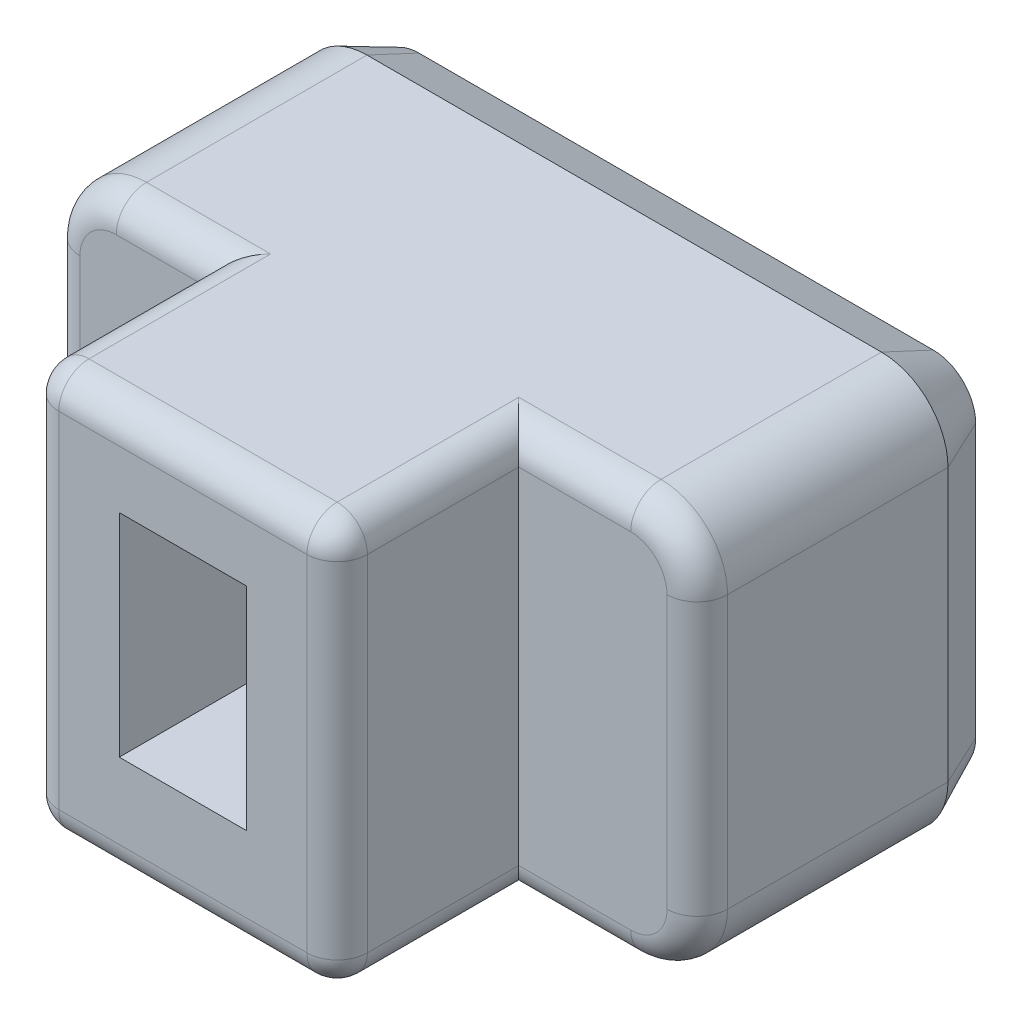
from build123d import *

# Parameters (mm, degrees)
BOSS_EXTRU_1_DEPTH      = 8
ESQUISSE3_W             = 2.1
ESQUISSE3_H             = 3.5
ENL_V_MAT_EXTRU_1_DEPTH = 3
ESQUISSE4_OUTSIDE_W     = 15.69
ESQUISSE4_OUTSIDE_H     = 11.69
ESQUISSE4_OUTSIDE_W_2   = 5.1
ESQUISSE4_OUTSIDE_H_2   = 6.7
ENL_V_MAT_EXTRU_2_DEPTH = 3
CONG_1_R                = 0.5
CHANFREIN1_SIZE         = 0.4
CHANFREIN1_SIZE2        = 0.857802768
ENL_V_MAT_EXTRU_3_DEPTH = 0.3
BOSS_EXTRU_2_START      = -0.2
BOSS_EXTRU_2_DEPTH      = 0.2
BOSS_EXTRU_2_2_DEPTH    = 0.2
BOSS_EXTRU_2_3_DEPTH    = 0.2


with BuildPart() as part:
    # Esquisse2 → Boss.-Extru.1 (new body)
    with BuildSketch(Plane.XY):
        with BuildLine():
            Line((1.1, 0), (9.6, 0))
            ThreePointArc((9.6, 0), (10.377817459, 0.322182541), (10.7, 1.1))
            Line((10.7, 1.1), (10.7, 5.6))
            ThreePointArc((10.7, 5.6), (10.377817459, 6.377817459), (9.6, 6.7))
            Line((9.6, 6.7), (1.1, 6.7))
            ThreePointArc((1.1, 6.7), (0.322182541, 6.377817459), (0, 5.6))
            Line((0, 5.6), (0, 1.1))
            ThreePointArc((0, 1.1), (0.322182541, 0.322182541), (1.1, 0))
        make_face()
    extrude(amount=BOSS_EXTRU_1_DEPTH)

    # Esquisse3 → Enlèv. mat.-Extru.1 (cut)
    with BuildSketch(Plane.XY.offset(8)):
        with Locations((5.2, 3.5)):
            Rectangle(ESQUISSE3_W, ESQUISSE3_H)
    extrude(amount=-ENL_V_MAT_EXTRU_1_DEPTH, mode=Mode.SUBTRACT)

    # Esquisse4 outside → Enlèv. mat.-Extru.2 (cut)
    with BuildSketch(Plane.XY.offset(8)):
        with Locations((5.35, 3.35)):
            Rectangle(ESQUISSE4_OUTSIDE_W, ESQUISSE4_OUTSIDE_H)
        with Locations((5.2, 3.35)):
            Rectangle(ESQUISSE4_OUTSIDE_W_2, ESQUISSE4_OUTSIDE_H_2, mode=Mode.SUBTRACT)
    extrude(amount=-ENL_V_MAT_EXTRU_2_DEPTH, mode=Mode.SUBTRACT)

    # Congé1
    cong_1_edges = [part.edges().sort_by_distance(p)[0] for p in [
        (8.675, 0, 5),
        (10.377817459, 0.322182541, 5),
        (10.7, 3.35, 5),
        (10.377817459, 6.377817459, 5),
        (1.875, 6.7, 5),
        (0.322182541, 6.377817459, 5),
        (1.875, 0, 5),
        (0.322182541, 0.322182541, 5),
        (7.75, 6.7, 6.5),
        (2.65, 6.7, 6.5),
        (7.75, 0, 6.5),
        (2.65, 0, 6.5),
        (2.65, 3.35, 8),
        (5.2, 6.7, 8),
        (7.75, 3.35, 8),
        (5.2, 0, 8),
        (8.675, 6.7, 5),
        (0, 3.35, 5),
    ]]
    fillet(cong_1_edges, radius=CONG_1_R)

    # Chanfrein1
    chanfrein1_edges = [part.edges().sort_by_distance(p)[0] for p in [
        (5.35, 0, 0),
        (10.377817459, 0.322182541, 0),
        (0.322182541, 0.322182541, 0),
        (10.7, 3.35, 0),
        (0, 3.35, 0),
        (10.377817459, 6.377817459, 0),
        (0.322182541, 6.377817459, 0),
        (5.35, 6.7, 0),
    ]]
    chanfrein1_side = [part.faces().sort_by_distance(p)[0] for p in [
        (5.35, 3.35, 0),
    ]]
    chamfer(chanfrein1_edges, length=CHANFREIN1_SIZE, length2=CHANFREIN1_SIZE2, reference=chanfrein1_side[0])

    # Esquisse5 → Enlèv. mat.-Extru.3 (cut)
    # profile 1 of 3: a face of its own
    with BuildSketch(Plane.XY.offset(0.2)):
        Polygon((1.023618725, 5.356639893), (1.023618725, 1.356639893), (1.088522571, 1.356639893), (3.177464879, 4.407120662), (3.177464879, 1.356639893), (3.485157187, 1.356639893), (3.485157187, 5.356639893), (3.415445648, 5.356639893), (1.331311033, 2.314171944), (1.331311033, 5.356639893), align=None)
    # profile 2 of 3: a face of its own
    with BuildSketch(Plane.XY.offset(0.2)):
        Polygon((5.382593084, 1.356639893), (6.715926417, 5.356639893), (6.38099052, 5.356639893), (5.953907187, 4.074588611), (4.75999693, 4.074588611), (4.332913597, 5.356639893), (3.997977699, 5.356639893), (5.331311033, 1.356639893), align=None)
        Polygon((5.356952058, 2.284524508), (4.897016161, 3.6643322), (5.816887956, 3.6643322), align=None, mode=Mode.SUBTRACT)
    # profile 3 of 3: a face of its own
    with BuildSketch(Plane.XY.offset(0.2)):
        Polygon((7.177464879, 1.356639893), (7.512400776, 1.356639893), (8.536439238, 4.427953995), (9.560477699, 1.356639893), (9.895413597, 1.356639893), (8.562080264, 5.356639893), (8.510798212, 5.356639893), align=None)
    extrude(amount=-ENL_V_MAT_EXTRU_3_DEPTH, mode=Mode.SUBTRACT)


with BuildPart() as body_2:
    # Esquisse5<3> → Boss.-Extru.2 (new body)
    with BuildSketch(Plane.XY.offset(0.2).offset(BOSS_EXTRU_2_START)):
        Polygon((1.023618725, 5.356639893), (1.023618725, 1.356639893), (1.088522571, 1.356639893), (3.177464879, 4.407120662), (3.177464879, 1.356639893), (3.485157187, 1.356639893), (3.485157187, 5.356639893), (3.415445648, 5.356639893), (1.331311033, 2.314171944), (1.331311033, 5.356639893), align=None)
    extrude(amount=-BOSS_EXTRU_2_DEPTH)


with BuildPart() as body_3:
    # Esquisse5<3> → Boss.-Extru.2 2 (new body)
    with BuildSketch(Plane.XY.offset(0.2).offset(BOSS_EXTRU_2_START)):
        Polygon((5.382593084, 1.356639893), (6.715926417, 5.356639893), (6.38099052, 5.356639893), (5.953907187, 4.074588611), (4.75999693, 4.074588611), (4.332913597, 5.356639893), (3.997977699, 5.356639893), (5.331311033, 1.356639893), align=None)
        Polygon((5.356952058, 2.284524508), (4.897016161, 3.6643322), (5.816887956, 3.6643322), align=None, mode=Mode.SUBTRACT)
    extrude(amount=-BOSS_EXTRU_2_2_DEPTH)


with BuildPart() as body_4:
    # Esquisse5<3> → Boss.-Extru.2 3 (new body)
    with BuildSketch(Plane.XY.offset(0.2).offset(BOSS_EXTRU_2_START)):
        Polygon((7.177464879, 1.356639893), (7.512400776, 1.356639893), (8.536439238, 4.427953995), (9.560477699, 1.356639893), (9.895413597, 1.356639893), (8.562080264, 5.356639893), (8.510798212, 5.356639893), align=None)
    extrude(amount=-BOSS_EXTRU_2_3_DEPTH)


solid = Compound([part.part, body_2.part, body_3.part, body_4.part])
